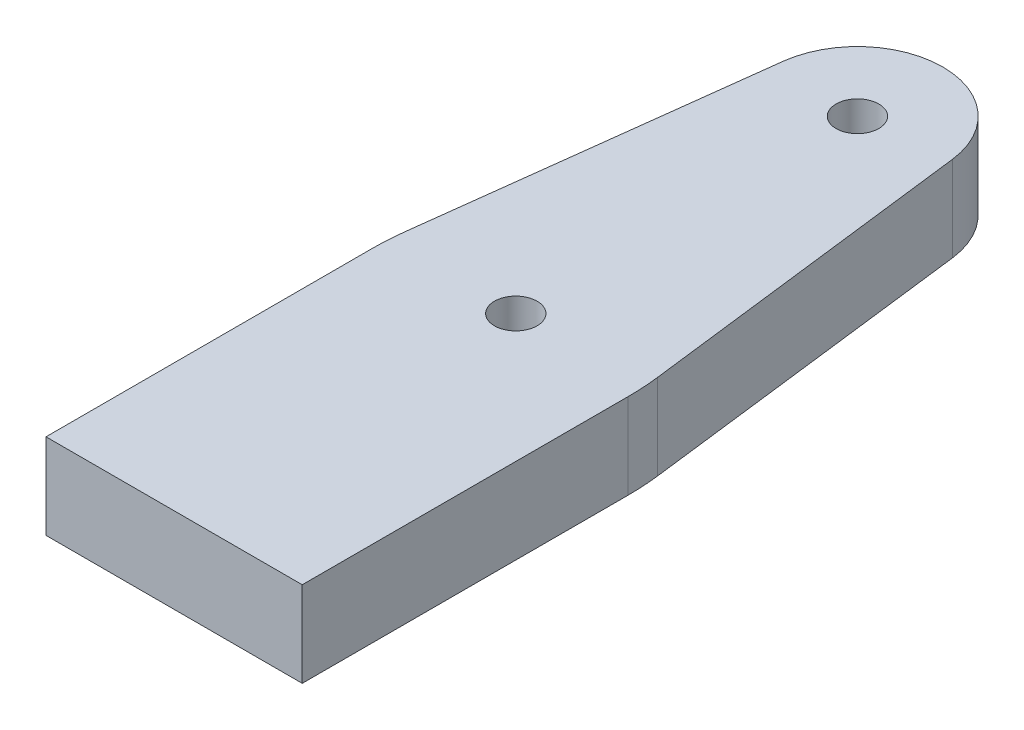
from build123d import *

# Parameters (mm, degrees)
SKETCH1_R           = 5
BOSS_EXTRUDE1_DEPTH = 5
FILLET1_R           = 15
SKETCH2_R           = 1.25
CUT_EXTRUDE1_DEPTH  = 42.003048667


with BuildPart() as part:
    # Sketch1 → Boss-Extrude1 (new body)
    with BuildSketch(Plane(origin=(0, 0, 0), x_dir=(1, 0, 0), z_dir=(0, 1, 0))):
        with BuildLine():
            ThreePointArc((5, 0), (-0.30604892, -4.990624616), (-4.962533624, 0.610950109))
            Line((-4.962533624, 0.610950109), (-7.5, -20))
            Line((-7.5, -20), (-7.5, -40))
            Line((-7.5, -40), (7.5, -40))
            Line((7.5, -40), (7.5, -20))
            Line((7.5, -20), (4.962533624, 0.610950109))
            ThreePointArc((4.962533624, 0.610950109), (4.990624616, 0.30604892), (5, 0))
        make_face()
        Circle(SKETCH1_R)
    extrude(amount=BOSS_EXTRUDE1_DEPTH)

    # Fillet1
    fillet1_edges = [part.edges().sort_by_distance(p)[0] for p in [
        (7.5, 2.5, 20),
        (-7.5, 2.5, 20),
    ]]
    fillet(fillet1_edges, radius=FILLET1_R)

    # Sketch2 → Cut-Extrude1 (cut, through all)
    with BuildSketch(Plane(origin=(0, 5, 0), x_dir=(1, 0, 0), z_dir=(0, 1, 0))):
        with Locations(Location((0, 0, 0), (0, 0, 270))):
            Circle(SKETCH2_R)
        with Locations(Location((0, -20, 0), (0, 0, 270))):
            Circle(SKETCH2_R)
    extrude(amount=-CUT_EXTRUDE1_DEPTH, mode=Mode.SUBTRACT)


solid = part.part
